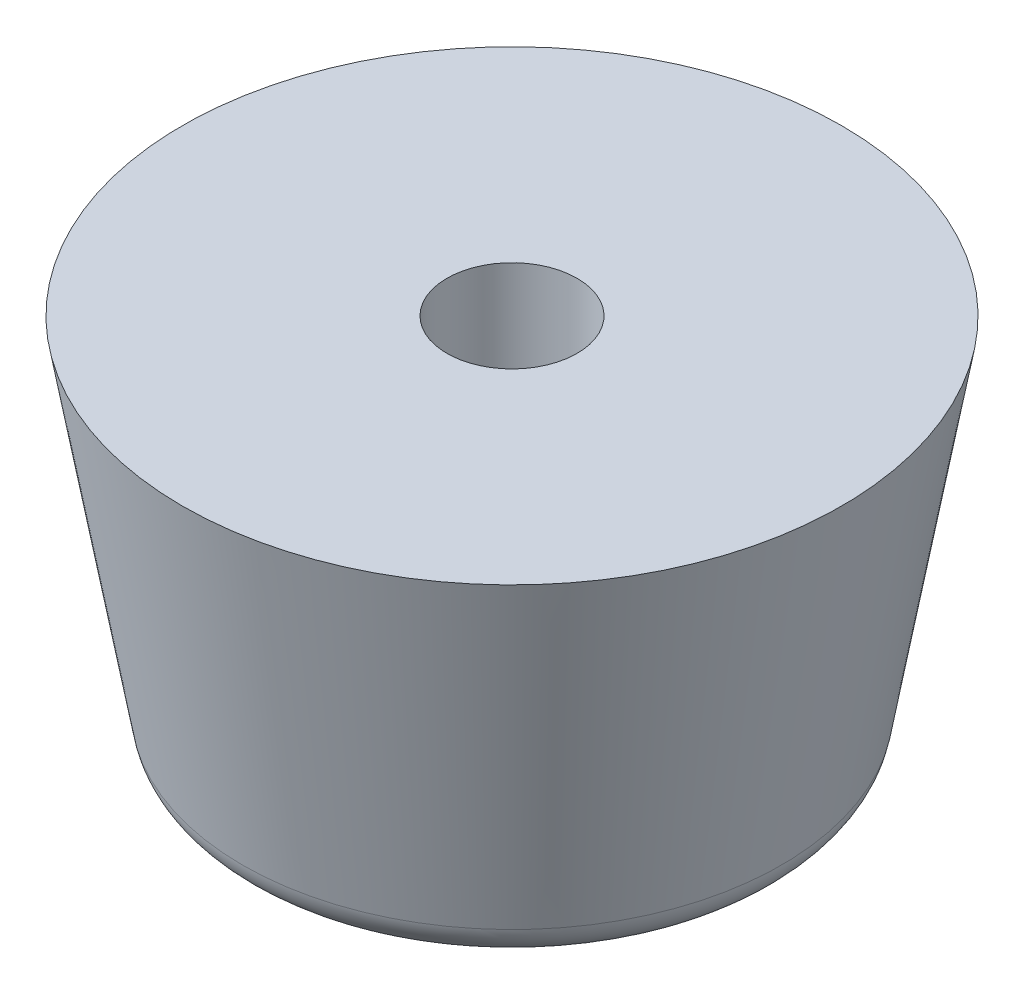
from build123d import *

# Parameters (mm, degrees)
ESBO_O1_R                = 15.19
RESSALTO_EXTRUS_O1_DEPTH = 17.37
RESSALTO_EXTRUS_O1_DRAFT = -10
ESBO_O2_R                = 5
CORTE_EXTRUS_O1_DEPTH    = 7
ESBO_O3_R                = 3
CORTE_EXTRUS_O2_DEPTH    = 24.853911629
FILETE1_R                = 2


with BuildPart() as part:
    # Esboço1 → Ressalto-extrusão1 (with draft: the straight prism first)
    with BuildSketch(Plane(origin=(0, 0, 0), x_dir=(1, 0, 0), z_dir=(0, 1, 0))):
        Circle(ESBO_O1_R)
    extrude(amount=-RESSALTO_EXTRUS_O1_DEPTH)
    # Ressalto-extrusão1: the draft: its side faces are tilted about the plane it starts from
    ressalto_extrus_o1_sides = [part.faces().sort_by_distance(p)[0] for p in [
        (-15.19, -8.685, 0),
    ]]
    draft(ressalto_extrus_o1_sides, Plane(origin=(0, 0, 0), x_dir=(1, 0, 0), z_dir=(0, 1, 0)), RESSALTO_EXTRUS_O1_DRAFT)

    # Esboço2 → Corte-extrusão1 (cut)
    with BuildSketch(Plane.XZ.offset(17.37)):
        with Locations(Location((0, 0, 0), (0, 0, 270))):
            Circle(ESBO_O2_R)
    extrude(amount=-CORTE_EXTRUS_O1_DEPTH, mode=Mode.SUBTRACT)

    # Esboço3 → Corte-extrusão2 (cut, through all)
    with BuildSketch(Plane.XZ.offset(10.37)):
        with Locations(Location((0, 0, 0), (0, 0, 270))):
            Circle(ESBO_O3_R)
    extrude(amount=-CORTE_EXTRUS_O2_DEPTH, mode=Mode.SUBTRACT)

    # Filete1
    filete1_edges = [part.edges().sort_by_distance(p)[0] for p in [
        (-12.127200345, -17.37, 0),
    ]]
    fillet(filete1_edges, radius=FILETE1_R)


solid = part.part
